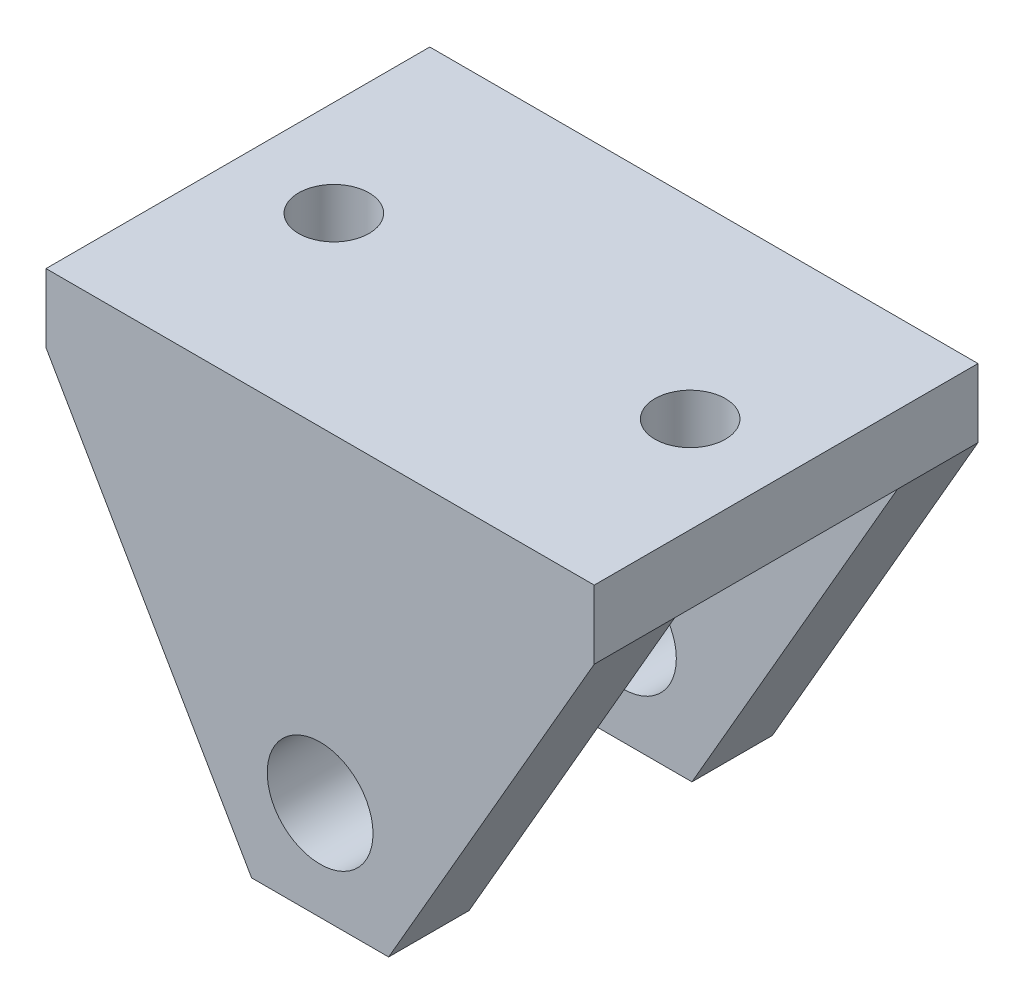
from build123d import *

# Parameters (mm, degrees)
SKETCH2_W           = 50.8
SKETCH2_H           = 35.56
SKETCH2_R           = 3.2639
BOSS_EXTRUDE1_DEPTH = 39.37
SKETCH4_R           = 4.9022
CUT_EXTRUDE1_DEPTH  = 59.818963779
SKETCH5_W           = 50.8
SKETCH5_H           = 20.6502
CUT_EXTRUDE2_DEPTH  = 33.02


with BuildPart() as part:
    # Sketch2 → Boss-Extrude1 (new body)
    with BuildSketch(Plane(origin=(0, 0, 0), x_dir=(1, 0, 0), z_dir=(0, 1, 0))):
        Rectangle(SKETCH2_W, SKETCH2_H)
        with Locations(Location((-16.51, 0, 0), (0, 0, 270))):
            Circle(SKETCH2_R, mode=Mode.SUBTRACT)
        with Locations(Location((16.51, 0, 0), (0, 0, 90))):
            Circle(SKETCH2_R, mode=Mode.SUBTRACT)
    extrude(amount=-BOSS_EXTRUDE1_DEPTH)

    # Sketch4 → Cut-Extrude1 (cut, through all)
    with BuildSketch(Plane.XY.offset(17.78)):
        with Locations((0, -30.196811844)):
            Circle(SKETCH4_R)
        Polygon((-25.4, -6.35), (-6.35, -39.37), (-25.4, -39.37), align=None)
        Polygon((6.35, -39.37), (25.4, -39.37), (25.4, -6.35), align=None)
    extrude(amount=-CUT_EXTRUDE1_DEPTH, mode=Mode.SUBTRACT)

    # Sketch5 → Cut-Extrude2 (cut)
    with BuildSketch(Plane.XZ.offset(39.37)):
        Rectangle(SKETCH5_W, SKETCH5_H)
    extrude(amount=-CUT_EXTRUDE2_DEPTH, mode=Mode.SUBTRACT)


solid = part.part
